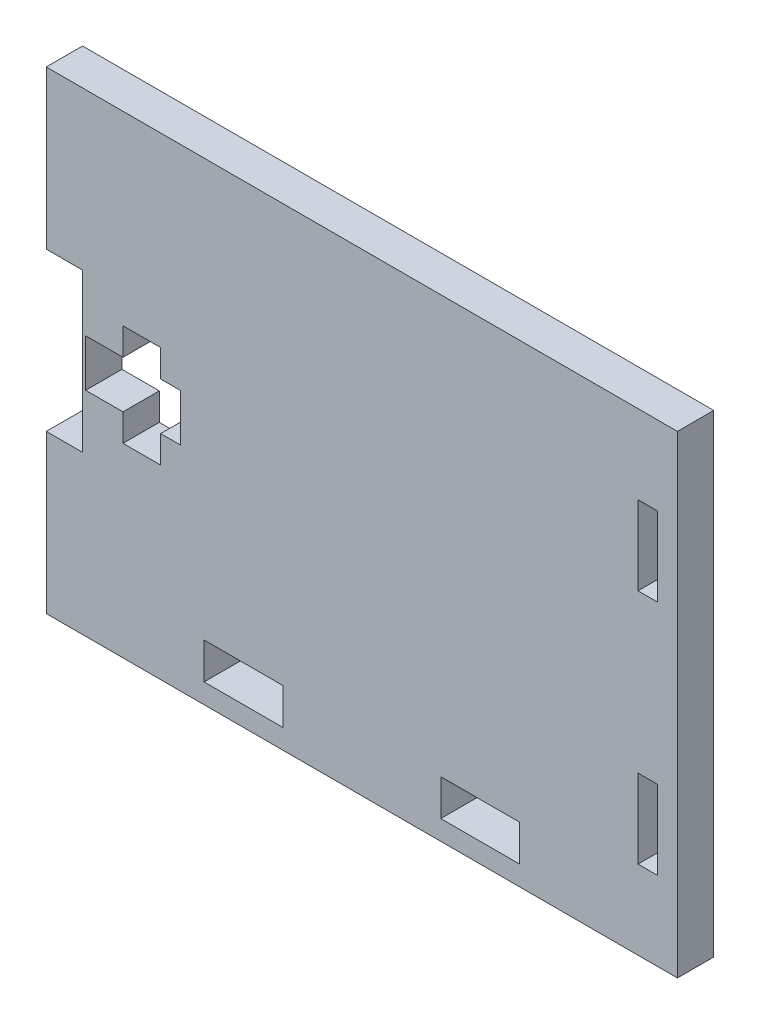
from build123d import *

# Parameters (mm, degrees)
SKETCH1_W           = 50.8
SKETCH1_H           = 38.1
BOSS_EXTRUDE1_DEPTH = 2.921
SKETCH2_W           = 6.35
SKETCH2_H           = 2.921
CUT_EXTRUDE1_DEPTH  = 63.628546983
SKETCH3_W           = 7.355919967
SKETCH3_H           = 12.7
CUT_EXTRUDE2_DEPTH  = 63.628546983
CUT_EXTRUDE3_DEPTH  = 63.628546983
SKETCH5_W           = 1.5875
SKETCH5_H           = 6.35
CUT_EXTRUDE4_DEPTH  = 63.628546983


with BuildPart() as part:
    # Sketch1 → Boss-Extrude1 (new body)
    with BuildSketch(Plane.XY):
        with Locations((25.4, 17.4625)):
            Rectangle(SKETCH1_W, SKETCH1_H)
    extrude(amount=-BOSS_EXTRUDE1_DEPTH)

    # Sketch2 → Cut-Extrude1 (cut, through all)
    with BuildSketch(Plane.XY):
        with Locations((15.875, 1.4605)):
            Rectangle(SKETCH2_W, SKETCH2_H)
        with Locations((34.925, 1.4605)):
            Rectangle(SKETCH2_W, SKETCH2_H)
    extrude(amount=-CUT_EXTRUDE1_DEPTH, mode=Mode.SUBTRACT)

    # Sketch3 → Cut-Extrude2 (cut, through all)
    with BuildSketch(Plane.XY):
        with Locations((-0.756959983, 17.4625)):
            Rectangle(SKETCH3_W, SKETCH3_H)
    extrude(amount=-CUT_EXTRUDE2_DEPTH, mode=Mode.SUBTRACT)

    # Sketch4 → Cut-Extrude3 (cut, through all)
    with BuildSketch(Plane.XY):
        Polygon((3.175, 19.36115), (6.175375, 19.36115), (6.175375, 21.55825), (9.2075, 21.55825), (9.2075, 19.36115), (10.795, 19.36115), (10.795, 15.56385), (9.2075, 15.56385), (9.2075, 13.36675), (6.175375, 13.36675), (6.175375, 15.56385), (3.175, 15.56385), align=None)
    extrude(amount=-CUT_EXTRUDE3_DEPTH, mode=Mode.SUBTRACT)

    # Sketch5 → Cut-Extrude4 (cut, through all)
    with BuildSketch(Plane.XY):
        with Locations((48.41875, 26.9875)):
            Rectangle(SKETCH5_W, SKETCH5_H)
        with Locations((48.41875, 7.9375)):
            Rectangle(SKETCH5_W, SKETCH5_H)
    extrude(amount=-CUT_EXTRUDE4_DEPTH, mode=Mode.SUBTRACT)


solid = part.part
